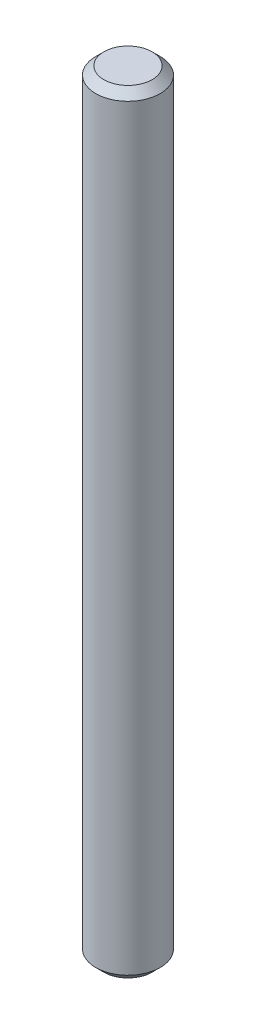
from build123d import *

# Parameters (mm, degrees)
SKETCH1_R      = 2
EXTRUDE1_DEPTH = 24
CHAMFER1_SIZE  = 0.5


with BuildPart() as part:
    # Sketch1 → Extrude1 (new, symmetric)
    with BuildSketch(Plane(origin=(0, 0, 0), x_dir=(1, 0, 0), z_dir=(0, 1, 0))):
        with Locations(Location((0, 0, 0), (0, 0, 270))):
            Circle(SKETCH1_R)
    extrude(amount=EXTRUDE1_DEPTH, both=True)

    # Chamfer1
    chamfer1_edges = [part.edges().sort_by_distance(p)[0] for p in [
        (0, -24, -2),
        (0, 24, -2),
    ]]
    chamfer(chamfer1_edges, length=CHAMFER1_SIZE)


solid = part.part
